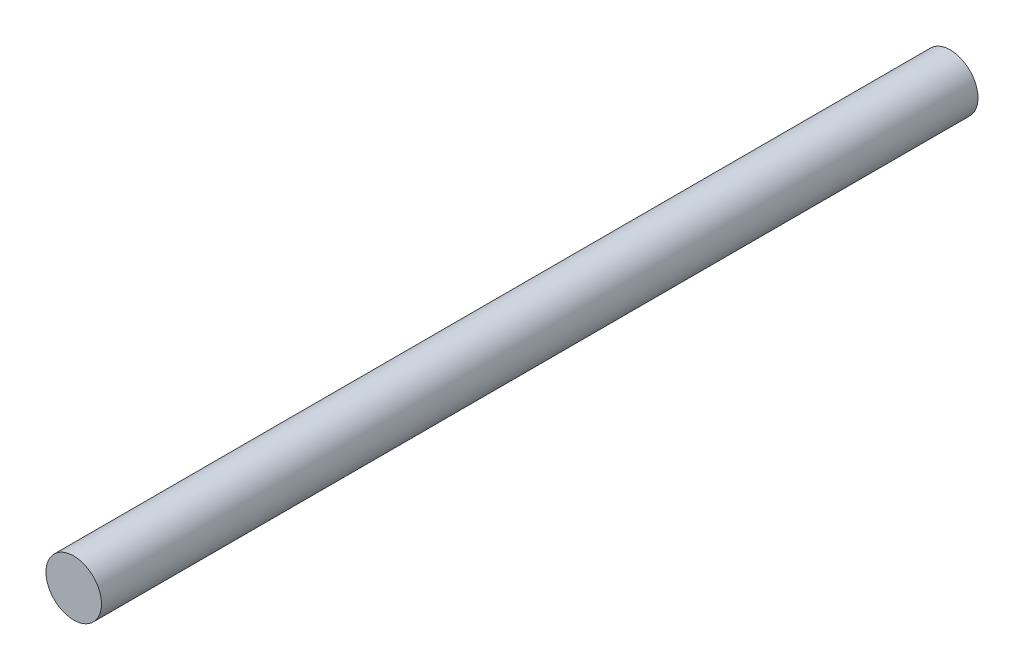
from build123d import *

# Parameters (mm, degrees)
SKETCH_1_R      = 1.9
EXTRUDE_1_DEPTH = 30


with BuildPart() as part:
    # 草图1 → 凸台-拉伸1 (new, symmetric)
    with BuildSketch(Plane.XY):
        Circle(SKETCH_1_R)
    extrude(amount=EXTRUDE_1_DEPTH, both=True)


solid = part.part
